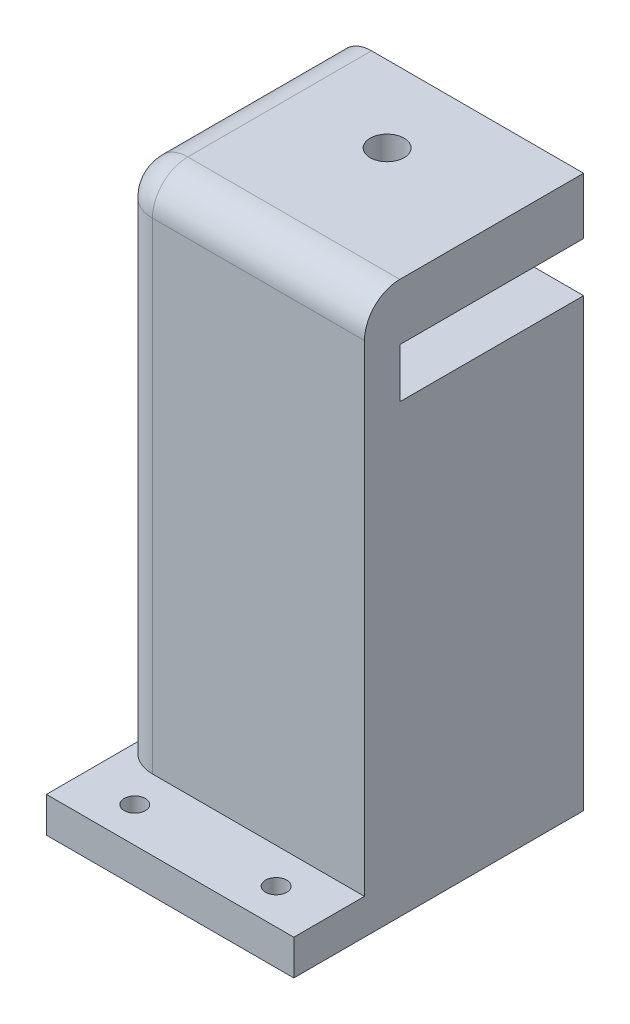
from build123d import *

# Parameters (mm, degrees)
SKETCH1_W           = 35
SKETCH1_H           = 41
BOSS_EXTRUDE1_DEPTH = 5
SKETCH2_R           = 1.5
CUT_EXTRUDE1_DEPTH  = 5
SKETCH3_W           = 35
SKETCH3_H           = 31
BOSS_EXTRUDE2_DEPTH = 73.1
SKETCH4_W           = 26
SKETCH4_H           = 7
CUT_EXTRUDE2_DEPTH  = 30
SKETCH5_R           = 2.4
CUT_EXTRUDE3_DEPTH  = 8
FILLET1_R           = 5
FILLET2_R           = 5


with BuildPart() as part:
    # Sketch1 → Boss-Extrude1 (new body)
    with BuildSketch(Plane(origin=(0, 0, 0), x_dir=(1, 0, 0), z_dir=(0, 1, 0))):
        with Locations((17.5, 20.5)):
            Rectangle(SKETCH1_W, SKETCH1_H)
    extrude(amount=BOSS_EXTRUDE1_DEPTH)

    # Sketch2 → Cut-Extrude1 (cut)
    with BuildSketch(Plane(origin=(0, 5, 0), x_dir=(1, 0, 0), z_dir=(0, 1, 0))):
        with Locations(Location((7.5, 5, 0), (0, 0, 270))):
            Circle(SKETCH2_R)
        with Locations(Location((27.5, 5, 0), (0, 0, 270))):
            Circle(SKETCH2_R)
    extrude(amount=-CUT_EXTRUDE1_DEPTH, mode=Mode.SUBTRACT)

    # Sketch3 → Boss-Extrude2 (add)
    with BuildSketch(Plane(origin=(0, 5, 0), x_dir=(1, 0, 0), z_dir=(0, 1, 0))):
        with Locations((17.5, 25.5)):
            Rectangle(SKETCH3_W, SKETCH3_H)
    extrude(amount=BOSS_EXTRUDE2_DEPTH)

    # Sketch4 → Cut-Extrude2 (cut)
    with BuildSketch(Plane(origin=(35, 0, 0), x_dir=(0, 0, -1), z_dir=(1, 0, 0))):
        with Locations((28, 66.6)):
            Rectangle(SKETCH4_W, SKETCH4_H)
    extrude(amount=-CUT_EXTRUDE2_DEPTH, mode=Mode.SUBTRACT)

    # Sketch5 → Cut-Extrude3 (cut)
    with BuildSketch(Plane(origin=(0, 78.1, 0), x_dir=(1, 0, 0), z_dir=(0, 1, 0))):
        with Locations(Location((18, 30.202102686, 0), (0, 0, 270))):
            Circle(SKETCH5_R)
    extrude(amount=-CUT_EXTRUDE3_DEPTH, mode=Mode.SUBTRACT)

    # Fillet1
    fillet1_edges = [part.edges().sort_by_distance(p)[0] for p in [
        (0, 78.1, -25.5),
    ]]
    fillet(fillet1_edges, radius=FILLET1_R)

    # Fillet2
    fillet2_edges = [part.edges().sort_by_distance(p)[0] for p in [
        (20, 78.1, -10),
        (0, 39.05, -10),
        (1.464466094, 76.635533906, -10),
    ]]
    fillet(fillet2_edges, radius=FILLET2_R)


solid = part.part
